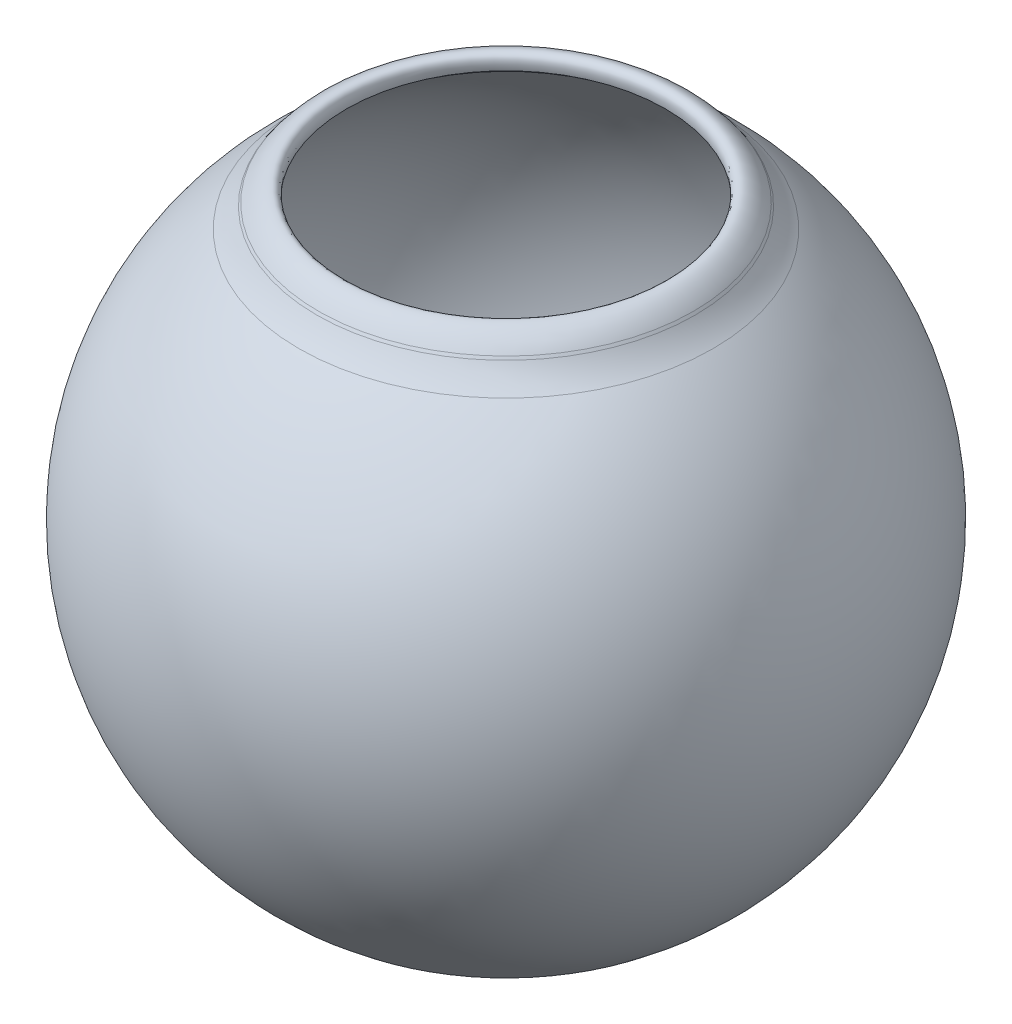
from build123d import *


with BuildPart() as part:
    # Sketch6 (on Front Plane) → sclera (revolve)
    with BuildSketch(Plane.XY):
        with BuildLine():
            Line((5.548153632, 4.336060606), (5.886123402, 4.08))
            Line((5.886123402, 4.08), (6.45968041, 3.692562089))
            ThreePointArc((6.45968041, 3.692562089), (10.457551069, -8.60076214), (0, -16.2))
            Line((0, -16.2), (0, -16.52))
            ThreePointArc((0, -16.52), (10.633298815, -9.043997424), (7.196762351, 3.491866142))
            ThreePointArc((7.196762351, 3.491866142), (6.859713943, 3.817824959), (6.577571883, 4.192320136))
            ThreePointArc((6.577571883, 4.192320136), (6.54936209, 4.236254975), (6.520858839, 4.28))
            add(Edge.make_bspline(
                [(5.548153632, 4.336060606), (5.40298249, 5.044933477), (6.051343216, 4.92625791), (6.520858839, 4.28)],
                knots=[0, 0, 0, 0, 1, 1, 1, 1], degree=3))
        make_face()
    revolve(axis=Axis((0, 6.398313168, 0), (0, -1, 0)))


solid = part.part
